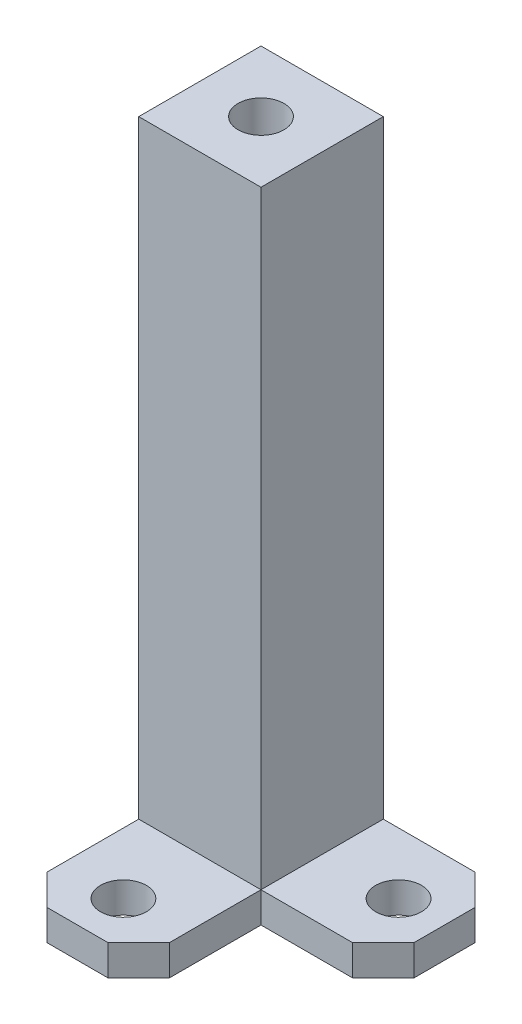
from build123d import *

# Parameters (mm, degrees)
SKETCH1_W           = 8
SKETCH1_H           = 8
BOSS_EXTRUDE1_DEPTH = 41.8
SKETCH2_R           = 1.5
CUT_EXTRUDE1_DEPTH  = 4
SKETCH3_W           = 8
SKETCH3_H           = 8
BOSS_EXTRUDE2_DEPTH = 2
SKETCH4_W           = 8
SKETCH4_H           = 8
BOSS_EXTRUDE3_DEPTH = 2
CHAMFER1_SIZE       = 2
SKETCH5_R           = 1.5
CUT_EXTRUDE2_DEPTH  = 2


with BuildPart() as part:
    # Sketch1 → Boss-Extrude1 (new body)
    with BuildSketch(Plane(origin=(0, 0, 0), x_dir=(1, 0, 0), z_dir=(0, 1, 0))):
        with Locations((4, 4)):
            Rectangle(SKETCH1_W, SKETCH1_H)
    extrude(amount=BOSS_EXTRUDE1_DEPTH)

    # Sketch2 → Cut-Extrude1 (cut)
    with BuildSketch(Plane(origin=(0, 41.8, 0), x_dir=(1, 0, 0), z_dir=(0, 1, 0))):
        with Locations(Location((4, 4, 0), (0, 0, 270))):
            Circle(SKETCH2_R)
    extrude(amount=-CUT_EXTRUDE1_DEPTH, mode=Mode.SUBTRACT)

    # Sketch3 → Boss-Extrude2 (add)
    with BuildSketch(Plane(origin=(0, 0, 0), x_dir=(1, 0, 0), z_dir=(0, 1, 0))):
        with Locations((12, 4)):
            Rectangle(SKETCH3_W, SKETCH3_H)
    extrude(amount=BOSS_EXTRUDE2_DEPTH)

    # Sketch4 → Boss-Extrude3 (add)
    with BuildSketch(Plane(origin=(0, 0, 0), x_dir=(1, 0, 0), z_dir=(0, 1, 0))):
        with Locations((4, -4)):
            Rectangle(SKETCH4_W, SKETCH4_H)
    extrude(amount=BOSS_EXTRUDE3_DEPTH)

    # Chamfer1
    chamfer1_edges = [part.edges().sort_by_distance(p)[0] for p in [
        (16, 1, 0),
        (16, 1, -8),
        (0, 1, 8),
        (8, 1, 8),
    ]]
    chamfer(chamfer1_edges, length=CHAMFER1_SIZE)

    # Sketch5 → Cut-Extrude2 (cut)
    with BuildSketch(Plane(origin=(0, 2, 0), x_dir=(1, 0, 0), z_dir=(0, 1, 0))):
        with Locations(Location((4, -5, 0), (0, 0, 270))):
            Circle(SKETCH5_R)
        with Locations(Location((13, 4, 0), (0, 0, 270))):
            Circle(SKETCH5_R)
    extrude(amount=-CUT_EXTRUDE2_DEPTH, mode=Mode.SUBTRACT)


solid = part.part
